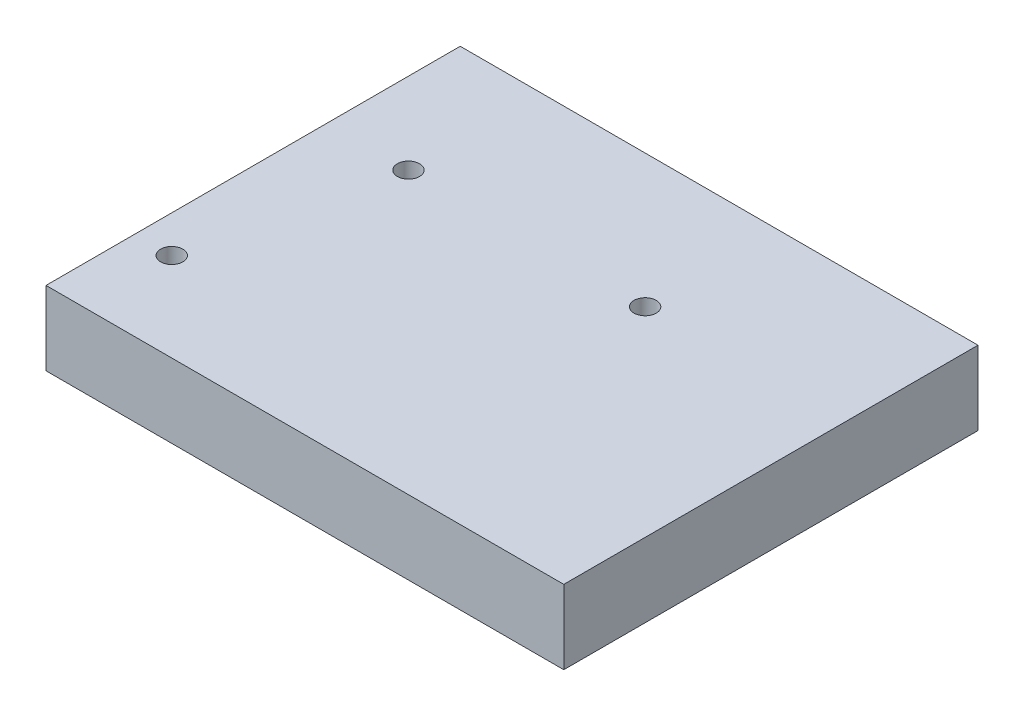
from build123d import *

# Parameters (mm, degrees)
SKETCH1_W           = 70
SKETCH1_H           = 56
BOSS_EXTRUDE1_DEPTH = 10
SKETCH2_R           = 1.5
CUT_EXTRUDE1_DEPTH  = 10


with BuildPart() as part:
    # Sketch1 → Boss-Extrude1 (new body)
    with BuildSketch(Plane(origin=(0, 0, 0), x_dir=(1, 0, 0), z_dir=(0, 1, 0))):
        Rectangle(SKETCH1_W, SKETCH1_H)
    extrude(amount=BOSS_EXTRUDE1_DEPTH)

    # Sketch2 → Cut-Extrude1 (cut)
    with BuildSketch(Plane(origin=(0, 10, 0), x_dir=(1, 0, 0), z_dir=(0, 1, 0))):
        with Locations(Location((-30, -16, 0), (0, 0, 270))):
            Circle(SKETCH2_R)
        with Locations(Location((-24, 10, 0), (0, 0, 270))):
            Circle(SKETCH2_R)
        with Locations(Location((8, 10, 0), (0, 0, 270))):
            Circle(SKETCH2_R)
    extrude(amount=-CUT_EXTRUDE1_DEPTH, mode=Mode.SUBTRACT)


solid = part.part
